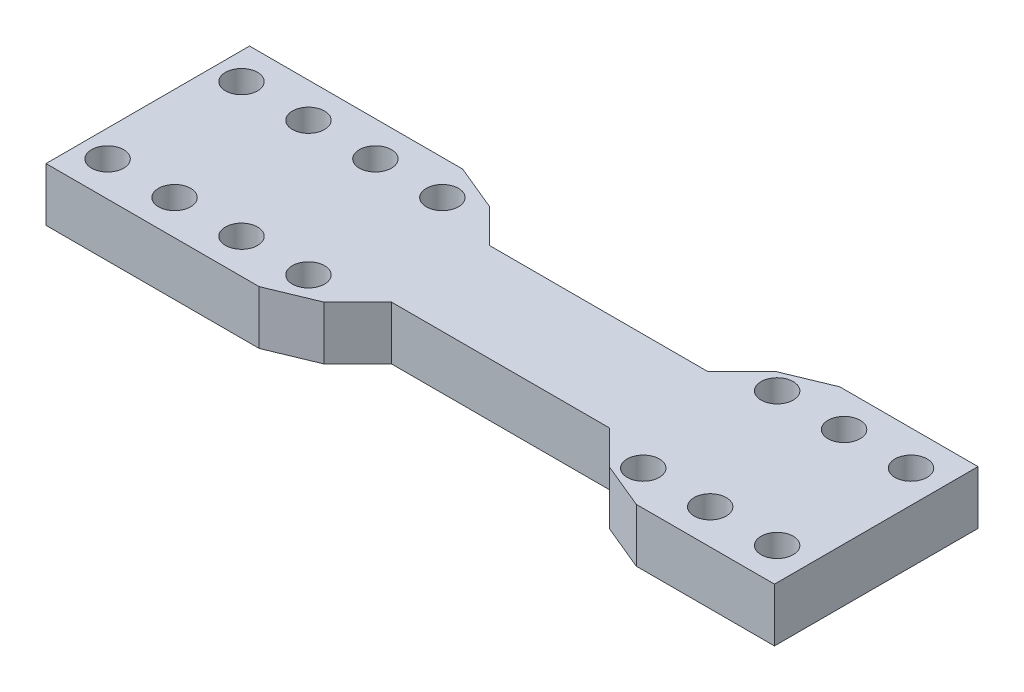
from build123d import *

# Parameters (mm, degrees)
SKETCH1_R           = 3
BOSS_EXTRUDE1_DEPTH = 10
CHAMFER1_SIZE       = 5


with BuildPart() as part:
    # Sketch1 → Boss-Extrude1 (new body)
    with BuildSketch(Plane(origin=(0, 0, 0), x_dir=(1, 0, 0), z_dir=(0, 1, 0))):
        Polygon((-26.18056889, 2.640536741), (-16.329229088, -7.210803061), (24.381205478, -7.210803061), (34.23254528, 2.640536741), (65.030497816, 2.640536741), (65.030497816, -35.359463259), (34.23254528, -35.359463259), (24.381205478, -25.508123456), (-16.329229088, -25.508123456), (-26.18056889, -35.359463259), (-70.969502184, -35.359463259), (-70.969502184, 2.640536741), align=None)
        with Locations(Location((-65.969502184, -3.859463259, 0), (0, 0, 270))):
            Circle(SKETCH1_R, mode=Mode.SUBTRACT)
        with Locations(Location((-40.969502184, -3.859463259, 0), (0, 0, 270))):
            Circle(SKETCH1_R, mode=Mode.SUBTRACT)
        with Locations(Location((-40.969502184, -28.859463259, 0), (0, 0, 270))):
            Circle(SKETCH1_R, mode=Mode.SUBTRACT)
        with Locations(Location((-65.969502184, -28.859463259, 0), (0, 0, 270))):
            Circle(SKETCH1_R, mode=Mode.SUBTRACT)
        with Locations(Location((-28.469502184, -28.859463259, 0), (0, 0, 270))):
            Circle(SKETCH1_R, mode=Mode.SUBTRACT)
        with Locations(Location((-53.469502184, -3.859463259, 0), (0, 0, 270))):
            Circle(SKETCH1_R, mode=Mode.SUBTRACT)
        with Locations(Location((-53.469502184, -28.859463259, 0), (0, 0, 270))):
            Circle(SKETCH1_R, mode=Mode.SUBTRACT)
        with Locations(Location((-28.469502184, -3.859463259, 0), (0, 0, 270))):
            Circle(SKETCH1_R, mode=Mode.SUBTRACT)
        with Locations(Location((34.030497816, -3.859463259, 0), (0, 0, 270))):
            Circle(SKETCH1_R, mode=Mode.SUBTRACT)
        with Locations(Location((59.030497816, -28.859463259, 0), (0, 0, 270))):
            Circle(SKETCH1_R, mode=Mode.SUBTRACT)
        with Locations(Location((59.030497816, -3.859463259, 0), (0, 0, 270))):
            Circle(SKETCH1_R, mode=Mode.SUBTRACT)
        with Locations(Location((34.030497816, -28.859463259, 0), (0, 0, 270))):
            Circle(SKETCH1_R, mode=Mode.SUBTRACT)
        with Locations(Location((46.530497816, -28.859463259, 0), (0, 0, 270))):
            Circle(SKETCH1_R, mode=Mode.SUBTRACT)
        with Locations(Location((46.530497816, -3.859463259, 0), (0, 0, 270))):
            Circle(SKETCH1_R, mode=Mode.SUBTRACT)
    extrude(amount=BOSS_EXTRUDE1_DEPTH)

    # Chamfer1
    chamfer1_edges = [part.edges().sort_by_distance(p)[0] for p in [
        (-26.18056889, 5, -2.640536741),
        (34.23254528, 5, -2.640536741),
        (34.23254528, 5, 35.359463259),
        (-26.18056889, 5, 35.359463259),
    ]]
    chamfer(chamfer1_edges, length=CHAMFER1_SIZE)


solid = part.part
